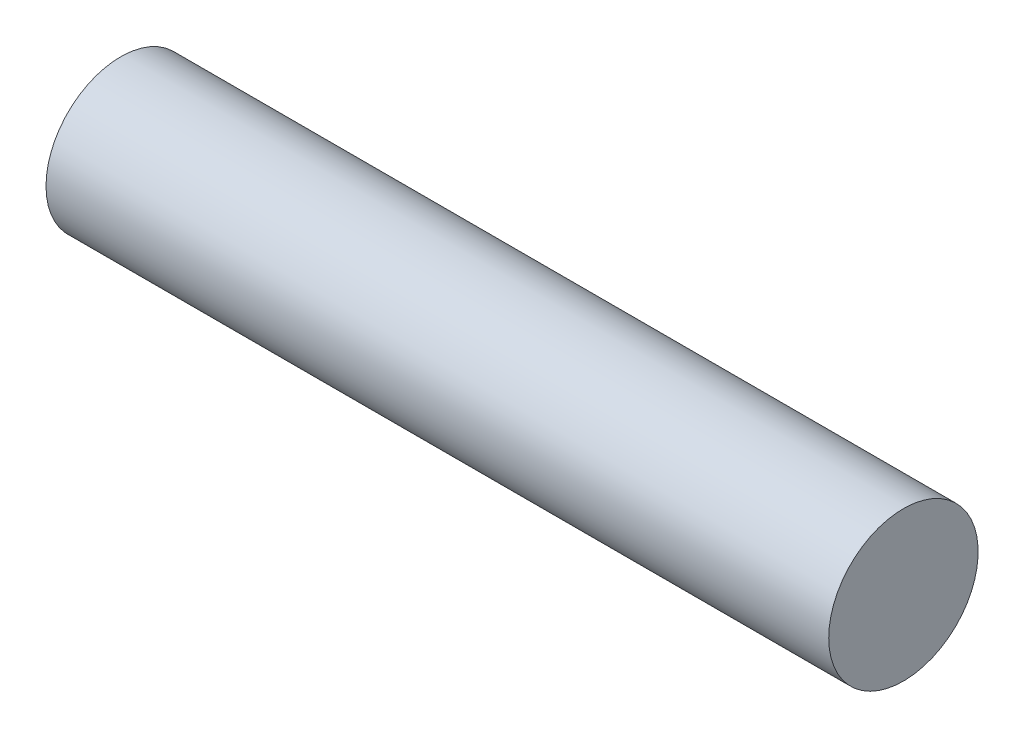
from build123d import *

# Parameters (mm, degrees)
SKETCH1_W = 11
SKETCH1_H = 1.05


with BuildPart() as part:
    # Sketch1 → Revolve1 (revolve)
    with BuildSketch(Plane.XY, mode=Mode.PRIVATE) as revolve1_sk:
        with Locations((-144.727441652, 0.525)):
            Rectangle(SKETCH1_W, SKETCH1_H)
    revolve(revolve1_sk.sketch.rotate(Axis((-150.227441652, 0, 0), (1, 0, 0)), 90), axis=Axis((-150.227441652, 0, 0), (1, 0, 0)))


solid = part.part
